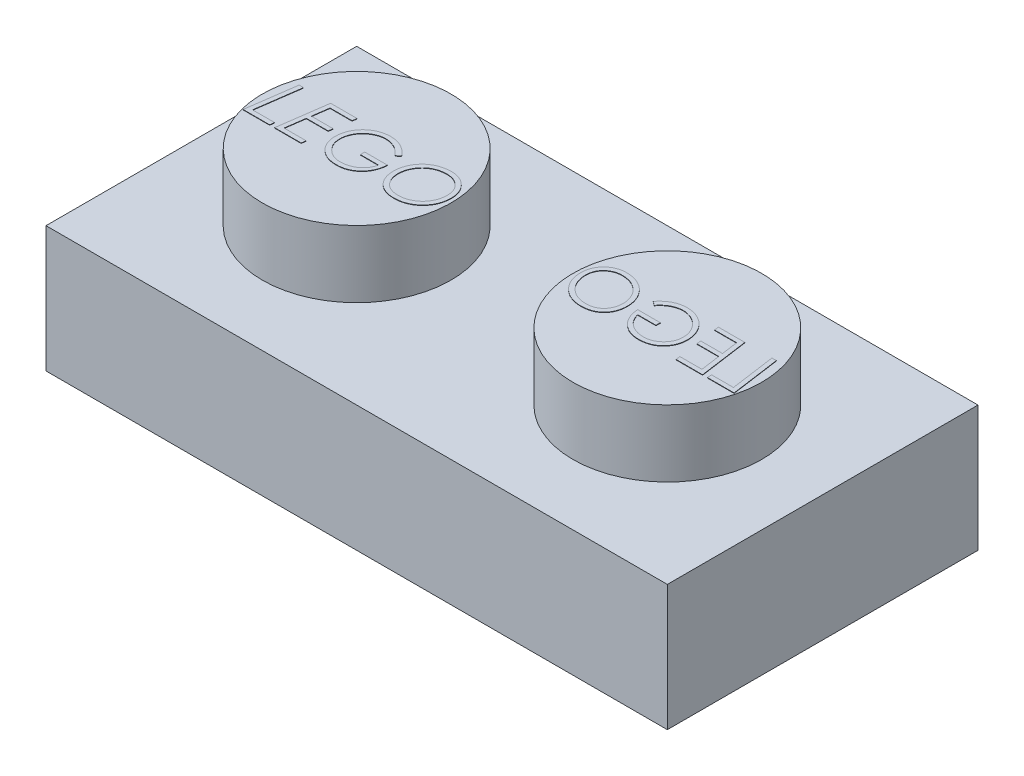
from build123d import *

# Parameters (mm, degrees)
SKETCH1_W           = 7.9
SKETCH1_H           = 7.9
BOSS_EXTRUDE1_DEPTH = 3.2
SKETCH2_R           = 2.4
BOSS_EXTRUDE2_DEPTH = 1.7
BOSS_EXTRUDE4_DEPTH = 0.01
SKETCH4_W           = 6.679581062
SKETCH4_H           = 6.679581062
CUT_EXTRUDE1_DEPTH  = 2.01
BOSS_EXTRUDE5_START = -2.01
BOSS_EXTRUDE5_DEPTH = 2.01


with BuildPart() as part:
    # Sketch1 → Boss-Extrude1 (new body)
    with BuildSketch(Plane(origin=(0, 0, 0), x_dir=(1, 0, 0), z_dir=(0, 1, 0))):
        with Locations((3.95, 3.95)):
            Rectangle(SKETCH1_W, SKETCH1_H)
    extrude(amount=BOSS_EXTRUDE1_DEPTH)

    # Sketch2 → Boss-Extrude2 (add)
    with BuildSketch(Plane(origin=(0, 3.2, 0), x_dir=(1, 0, 0), z_dir=(0, 1, 0))):
        with Locations(Location((3.95, 3.95, 0), (0, 0, 270))):
            Circle(SKETCH2_R)
    extrude(amount=BOSS_EXTRUDE2_DEPTH)

    # Sketch3 → Boss-Extrude4 (add)
    # profile 1 of 4: a face of its own
    with BuildSketch(Plane(origin=(0, 4.9, 0), x_dir=(1, 0, 0), z_dir=(0, 1, 0))):
        Polygon((1.832282536, 4.604898123), (1.945463626, 4.604898123), (1.785708017, 3.46707761), (2.346104652, 3.46707761), (2.331831815, 3.354898123), (1.657002088, 3.354898123), align=None)
    # profile 2 of 4: a face of its own
    with BuildSketch(Plane(origin=(0, 4.9, 0), x_dir=(1, 0, 0), z_dir=(0, 1, 0))):
        Polygon((3.307643113, 4.604898123), (3.289864668, 4.492718636), (2.730720036, 4.492718636), (2.672376687, 4.076051969), (3.227514908, 4.076051969), (3.211489267, 3.963872482), (2.656351046, 3.963872482), (2.586990069, 3.46707761), (3.147386703, 3.46707761), (3.132863466, 3.354898123), (2.458284139, 3.354898123), (2.633564588, 4.604898123), align=None)
    # profile 3 of 4: a face of its own
    with BuildSketch(Plane(origin=(0, 4.9, 0), x_dir=(1, 0, 0), z_dir=(0, 1, 0))):
        with BuildLine():
            Line((4.701873883, 4.341727049), (4.602214428, 4.268359661))
            add(Edge.make_bspline(
                [(4.602214428, 4.268359661), (4.594223081, 4.278463296), (4.578382454, 4.298490949), (4.552974208, 4.326751799), (4.526781942, 4.353389692), (4.49925824, 4.377917229), (4.471083571, 4.40112998), (4.441525281, 4.42204341), (4.410978563, 4.441207159), (4.379659496, 4.458649755), (4.347610579, 4.474125482), (4.315396207, 4.487732834), (4.282869127, 4.498922357), (4.250283005, 4.50864136), (4.217299487, 4.51587276), (4.18414763, 4.520710487), (4.150903008, 4.524293062), (4.128633082, 4.524610402), (4.117438786, 4.524769918)],
                knots=[0, 0, 0, 0, 1.088205139, 2.157064813, 3.209299296, 4.24303109, 5.270682624, 6.292193363, 7.299904734, 8.316436989, 9.319473328, 10.305733085, 11.269264382, 12.22444877, 13.177574148, 14.119122834, 15.054550362, 16, 16, 16, 16], degree=3))
            add(Edge.make_bspline(
                [(4.117438786, 4.524769918), (4.104994375, 4.524521107), (4.080132736, 4.524024028), (4.043033101, 4.520256885), (4.006376299, 4.51354748), (3.969908323, 4.504926578), (3.933893833, 4.493301772), (3.898252767, 4.479273564), (3.86309309, 4.462612711), (3.828430169, 4.443710217), (3.794953431, 4.422557236), (3.762954424, 4.399818018), (3.733183783, 4.375017311), (3.704650221, 4.34913067), (3.678490591, 4.320990985), (3.654040353, 4.291325456), (3.631570613, 4.259970376), (3.610753816, 4.22729124), (3.592321888, 4.193377608), (3.576332398, 4.158696131), (3.562301633, 4.123622124), (3.551463822, 4.087613068), (3.542488613, 4.051135011), (3.536702509, 4.013925289), (3.532682003, 3.976230124), (3.532229884, 3.950862463), (3.532002088, 3.938081216)],
                knots=[0, 0, 0, 0, 0.97704485, 1.95195533, 2.923843304, 3.901415526, 4.89212417, 5.89249681, 6.906854198, 7.94508701, 8.99059592, 10.014519948, 11.024825533, 12.031297736, 13.037428488, 14.038509295, 15.047964276, 16.064309815, 17.079005887, 18.075937854, 19.061713623, 20.042247028, 21.026191147, 22.008802999, 22.996754876, 24, 24, 24, 24], degree=3))
            add(Edge.make_bspline(
                [(3.532002088, 3.938081216), (3.532369323, 3.920940483), (3.533092921, 3.887166428), (3.54080397, 3.83756171), (3.552297071, 3.789703796), (3.569345009, 3.743984102), (3.590663785, 3.700113704), (3.616898701, 3.658340736), (3.647995923, 3.618632516), (3.683169388, 3.581124089), (3.721975609, 3.547190184), (3.762989457, 3.517071082), (3.806208637, 3.491553815), (3.851780792, 3.471217023), (3.899058754, 3.454481236), (3.948703848, 3.443615036), (4.000192874, 3.436168993), (4.035279814, 3.435410998), (4.053085822, 3.435026328)],
                knots=[0, 0, 0, 0, 1.019699772, 2.00921373, 2.981850619, 3.945611549, 4.907936516, 5.881372837, 6.876399243, 7.906447893, 8.938173367, 9.941073143, 10.932270214, 11.919723139, 12.908225854, 13.912405215, 14.940582182, 16, 16, 16, 16], degree=3))
            add(Edge.make_bspline(
                [(4.053085822, 3.435026328), (4.074581254, 3.435599426), (4.11748625, 3.436743331), (4.180872469, 3.447608002), (4.243162184, 3.464003995), (4.303115661, 3.48756372), (4.359892332, 3.516274774), (4.411741714, 3.54979345), (4.457784869, 3.587961635), (4.498384943, 3.630580026), (4.53303885, 3.678554542), (4.563120551, 3.731230233), (4.587740602, 3.789373269), (4.599634966, 3.830601123), (4.605720036, 3.851692995)],
                knots=[0, 0, 0, 0, 1.033792167, 2.063454529, 3.086685911, 4.12966393, 5.157365104, 6.144632769, 7.094686579, 8.02963692, 8.969786061, 9.935985671, 10.944065236, 12, 12, 12, 12], degree=3))
            Line((4.605720036, 3.851692995), (4.140976447, 3.851692995))
            Line((4.140976447, 3.851692995), (4.140976447, 3.963872482))
            Line((4.140976447, 3.963872482), (4.717899524, 3.963872482))
            add(Edge.make_bspline(
                [(4.717899524, 3.963872482), (4.715864452, 3.940537279), (4.711874195, 3.894782885), (4.69942647, 3.828086612), (4.68199329, 3.764774229), (4.659173945, 3.704861641), (4.630919519, 3.648505742), (4.59774963, 3.595348644), (4.559285746, 3.545571633), (4.515814341, 3.499721655), (4.46844757, 3.458302738), (4.417878433, 3.421925394), (4.364351012, 3.391393009), (4.308182236, 3.366007973), (4.248908241, 3.346854494), (4.187007442, 3.33278705), (4.12217798, 3.324364805), (4.078067373, 3.323359246), (4.055589828, 3.322846841)],
                knots=[0, 0, 0, 0, 1.098006248, 2.152910829, 3.176693714, 4.174102283, 5.154427425, 6.128677043, 7.108165613, 8.099464247, 9.087077226, 10.054952015, 11.015803916, 11.972468591, 12.940477937, 13.931877037, 14.946141749, 16, 16, 16, 16], degree=3))
            add(Edge.make_bspline(
                [(4.055589828, 3.322846841), (4.032525547, 3.323342362), (3.987411429, 3.324311611), (3.9214857, 3.332876212), (3.858807865, 3.34620412), (3.799404334, 3.365318809), (3.743277296, 3.389857102), (3.690679177, 3.420179827), (3.641268759, 3.455657405), (3.595689928, 3.496348401), (3.554559756, 3.541197331), (3.518567584, 3.589307242), (3.487743642, 3.639999747), (3.462901044, 3.693721351), (3.443468533, 3.750181555), (3.429856098, 3.809437188), (3.421311108, 3.871476007), (3.420325278, 3.913764014), (3.419822601, 3.935326809)],
                knots=[0, 0, 0, 0, 1.117903688, 2.186638197, 3.21780727, 4.221242465, 5.20706516, 6.182431358, 7.159609539, 8.151436913, 9.139682433, 10.10533578, 11.060397566, 12.011007066, 12.969638005, 13.950363306, 14.954883424, 16, 16, 16, 16], degree=3))
            add(Edge.make_bspline(
                [(3.419822601, 3.935326809), (3.420138952, 3.950859376), (3.420767729, 3.981731803), (3.424963713, 4.027616327), (3.432679126, 4.072646659), (3.442852825, 4.116910735), (3.455965552, 4.160496846), (3.471933961, 4.20328178), (3.491087489, 4.245242481), (3.513047729, 4.286115161), (3.537530339, 4.325600602), (3.564271155, 4.363247138), (3.593498243, 4.398542313), (3.624507556, 4.432098501), (3.658146201, 4.463054417), (3.693847346, 4.491888255), (3.731480716, 4.518905381), (3.77142415, 4.543221398), (3.812846375, 4.565137356), (3.855118915, 4.584605211), (3.898469674, 4.600573637), (3.942428974, 4.613905323), (3.987291028, 4.624144078), (4.032916476, 4.631801844), (4.079465257, 4.63599767), (4.110753822, 4.636631416), (4.12645321, 4.636949405)],
                knots=[0, 0, 0, 0, 1.01034602, 2.008157081, 2.993527994, 3.979930372, 4.960683832, 5.951959865, 6.948100503, 7.958563211, 8.967975239, 9.968308804, 10.959584837, 11.946808627, 12.938010319, 13.930059161, 14.930392727, 15.949048275, 16.969091794, 17.977364349, 18.973726886, 19.971641333, 20.963333569, 21.964771492, 22.978801278, 24, 24, 24, 24], degree=3))
            add(Edge.make_bspline(
                [(4.12645321, 4.636949405), (4.140647989, 4.63666956), (4.168739982, 4.636115737), (4.210476499, 4.63288549), (4.251380819, 4.627152534), (4.29129634, 4.618801418), (4.330484053, 4.608567941), (4.368675988, 4.59577053), (4.406070924, 4.580754735), (4.442474857, 4.563343269), (4.478143584, 4.543914061), (4.512619765, 4.521658579), (4.546625807, 4.497640881), (4.579591338, 4.471153536), (4.611552577, 4.442077414), (4.642675265, 4.410871755), (4.673242279, 4.377555225), (4.692243855, 4.353777591), (4.701873883, 4.341727049)],
                knots=[0, 0, 0, 0, 1.015105213, 2.008930748, 2.991454354, 3.966534974, 4.923490216, 5.886087319, 6.844809209, 7.803252371, 8.770243484, 9.747130909, 10.735853235, 11.746297741, 12.768902994, 13.824016992, 14.897208497, 16, 16, 16, 16], degree=3))
        make_face()
    # profile 4 of 4: a face of its own
    with BuildSketch(Plane(origin=(0, 4.9, 0), x_dir=(1, 0, 0), z_dir=(0, 1, 0))):
        with BuildLine():
            add(Edge.make_bspline(
                [(5.671925966, 4.636949405), (5.692400623, 4.63650345), (5.732667893, 4.635626396), (5.791703582, 4.627669814), (5.84816478, 4.614697282), (5.901922783, 4.596339067), (5.953136821, 4.572927607), (6.001690741, 4.544284414), (6.047399306, 4.510158163), (6.09025375, 4.471611385), (6.129154607, 4.429051867), (6.163160058, 4.383201547), (6.192058383, 4.334734533), (6.215910086, 4.283554512), (6.233823478, 4.229366588), (6.246743033, 4.172603876), (6.255145963, 4.113110877), (6.255950492, 4.072491917), (6.256361062, 4.051763107)],
                knots=[0, 0, 0, 0, 1.061681398, 2.087996504, 3.083659545, 4.062660971, 5.02945529, 5.999994507, 6.981138296, 7.983640916, 8.985844288, 9.966988076, 10.939736476, 11.908342154, 12.890058995, 13.894159216, 14.925339913, 16, 16, 16, 16], degree=3))
            add(Edge.make_bspline(
                [(6.256361062, 4.051763107), (6.25623821, 4.038988627), (6.255995471, 4.01374805), (6.253408976, 3.976225127), (6.249128591, 3.939561124), (6.243455349, 3.903597875), (6.235835613, 3.868539787), (6.226924527, 3.834140064), (6.216051359, 3.800598383), (6.20384118, 3.767696929), (6.189792262, 3.735595516), (6.173946521, 3.704324105), (6.15669213, 3.673663515), (6.137607818, 3.643838863), (6.11686312, 3.614849105), (6.094393683, 3.586665409), (6.070489857, 3.559187301), (6.044887258, 3.532733386), (6.018336956, 3.507212599), (5.990529993, 3.48355884), (5.962091012, 3.461350566), (5.932834084, 3.440746086), (5.90250067, 3.422121085), (5.871581935, 3.404690573), (5.839905885, 3.388861691), (5.807185809, 3.375183309), (5.773789823, 3.362832151), (5.739620564, 3.352089492), (5.704582969, 3.343076229), (5.668762424, 3.335500733), (5.632062087, 3.329787275), (5.594535036, 3.325855801), (5.556279304, 3.323200874), (5.530454147, 3.322965537), (5.51742877, 3.322846841)],
                knots=[0, 0, 0, 0, 1.057694632, 2.089855924, 3.112648636, 4.113725536, 5.103331559, 6.082381806, 7.055068159, 8.021768845, 8.98743121, 9.954922249, 10.923671581, 11.89959402, 12.885451751, 13.874212627, 14.883322035, 15.900071676, 16.921812937, 17.931632203, 18.921551953, 19.909055848, 20.892997665, 21.867769094, 22.84762411, 23.823252803, 24.802912784, 25.795362855, 26.787788858, 27.797679081, 28.826061376, 29.861826465, 30.921574152, 32, 32, 32, 32], degree=3))
            add(Edge.make_bspline(
                [(5.51742877, 3.322846841), (5.495540081, 3.323312388), (5.45279647, 3.324221496), (5.390401025, 3.331753811), (5.331466149, 3.34468508), (5.275615882, 3.361975519), (5.223270197, 3.38492417), (5.174339628, 3.412892082), (5.128783581, 3.445910526), (5.086763869, 3.483632016), (5.049135515, 3.525626819), (5.016044394, 3.570822838), (4.988418107, 3.619388761), (4.96538613, 3.670881503), (4.948106883, 3.725740589), (4.935156589, 3.783416472), (4.927613141, 3.844314319), (4.926699871, 3.88597706), (4.926232857, 3.907281937)],
                knots=[0, 0, 0, 0, 1.121422378, 2.189881799, 3.214223923, 4.209829567, 5.180887389, 6.136870002, 7.092517675, 8.058664933, 9.02481219, 9.976998316, 10.923432162, 11.882748215, 12.86205079, 13.865508147, 14.908495107, 16, 16, 16, 16], degree=3))
            add(Edge.make_bspline(
                [(4.926232857, 3.907281937), (4.92651465, 3.92390256), (4.927073619, 3.956871533), (4.931757127, 4.005792823), (4.939128338, 4.053761359), (4.950024433, 4.100549976), (4.963594459, 4.14639076), (4.979990494, 4.191253803), (5.000003008, 4.234848241), (5.022452359, 4.277389438), (5.047513645, 4.318359564), (5.07559856, 4.356880644), (5.105216605, 4.393691441), (5.137816677, 4.42780852), (5.172496353, 4.459796588), (5.209524734, 4.489546335), (5.248906172, 4.516814917), (5.290422211, 4.541753927), (5.333531205, 4.564369022), (5.378335052, 4.583562961), (5.424193072, 4.600182058), (5.471345954, 4.613795807), (5.519847317, 4.623918047), (5.569406413, 4.631466127), (5.620254649, 4.636113027), (5.6545551, 4.636668231), (5.671925966, 4.636949405)],
                knots=[0, 0, 0, 0, 1.027038055, 2.037251559, 3.03463374, 4.024476576, 5.003805404, 5.987972729, 6.973761106, 7.966047439, 8.95963362, 9.938921687, 10.910571097, 11.877553313, 12.852319973, 13.824735949, 14.81069978, 15.81041387, 16.816403723, 17.816876174, 18.82042938, 19.829469955, 20.847307225, 21.880377804, 22.926554263, 24, 24, 24, 24], degree=3))
        make_face()
        with BuildLine():
            add(Edge.make_bspline(
                [(5.671925966, 4.524769918), (5.65697579, 4.524545747), (5.627444828, 4.524102944), (5.583747158, 4.520086709), (5.541191397, 4.514393729), (5.499970629, 4.505322476), (5.459846772, 4.494612055), (5.421182876, 4.480527241), (5.383524652, 4.464643931), (5.34726264, 4.446055377), (5.312516644, 4.425361321), (5.279529586, 4.402463835), (5.248469657, 4.377453479), (5.219370347, 4.350164922), (5.191739723, 4.321307483), (5.166361885, 4.289965789), (5.142845474, 4.256628787), (5.121196386, 4.221501346), (5.10164712, 4.185107003), (5.08492909, 4.147719282), (5.070612165, 4.109847114), (5.058744989, 4.071497155), (5.049737471, 4.032481304), (5.043287884, 3.99291855), (5.039049877, 3.95269661), (5.03862585, 3.92565532), (5.038412344, 3.912039549)],
                knots=[0, 0, 0, 0, 1.093710758, 2.16039807, 3.20900896, 4.233234191, 5.246749975, 6.245527847, 7.241594159, 8.235879922, 9.224691631, 10.198908654, 11.171861231, 12.139893662, 13.116290872, 14.093089164, 15.087825051, 16.099756899, 17.110766713, 18.108591704, 19.094380672, 20.071961556, 21.043859171, 22.021859724, 23.00397114, 24, 24, 24, 24], degree=3))
            add(Edge.make_bspline(
                [(5.038412344, 3.912039549), (5.038625982, 3.900599914), (5.039049193, 3.877938292), (5.041777549, 3.844392517), (5.046595514, 3.811801965), (5.053065301, 3.780081073), (5.061542906, 3.749273697), (5.072183234, 3.719394567), (5.084405544, 3.690349568), (5.098393626, 3.662290632), (5.114175341, 3.635553687), (5.131389377, 3.61020951), (5.150226394, 3.586682218), (5.170360361, 3.564729612), (5.191972025, 3.544421151), (5.214980987, 3.52555365), (5.239648771, 3.508615875), (5.265465573, 3.492943288), (5.292687864, 3.479247808), (5.321165948, 3.467438697), (5.350786278, 3.457432665), (5.381544214, 3.449135171), (5.413524888, 3.442928532), (5.44663118, 3.438448028), (5.480905707, 3.435639812), (5.504152208, 3.435232585), (5.515926367, 3.435026328)],
                knots=[0, 0, 0, 0, 1.083699529, 2.146780792, 3.185591126, 4.202843058, 5.211856999, 6.209655863, 7.20532214, 8.195415879, 9.177202942, 10.14436246, 11.095191523, 12.029705806, 12.963818608, 13.902338257, 14.845476191, 15.796042213, 16.761390084, 17.729066592, 18.714222808, 19.721158958, 20.74459932, 21.797962164, 22.884686177, 24, 24, 24, 24], degree=3))
            add(Edge.make_bspline(
                [(5.515926367, 3.435026328), (5.530044188, 3.435228857), (5.558004277, 3.435629962), (5.599524853, 3.440000997), (5.64032433, 3.445959686), (5.680325762, 3.455225454), (5.71965402, 3.466535035), (5.757982705, 3.481070895), (5.795756024, 3.497476377), (5.83237428, 3.51683082), (5.867802238, 3.538111172), (5.901266528, 3.561837848), (5.932774032, 3.587459191), (5.962816859, 3.614626895), (5.990234918, 3.644356353), (6.016009711, 3.675809964), (6.039684501, 3.709331455), (6.061465654, 3.744601276), (6.080935982, 3.781209824), (6.097718361, 3.818903041), (6.112024773, 3.857287248), (6.123844079, 3.896320217), (6.132886835, 3.936161865), (6.139301688, 3.976648339), (6.14355343, 4.017951988), (6.143970816, 4.04574289), (6.144181575, 4.059775927)],
                knots=[0, 0, 0, 0, 1.029812959, 2.039525905, 3.043952503, 4.036919093, 5.033391511, 6.027870106, 7.026035071, 8.036794627, 9.047957848, 10.039952554, 11.027355318, 12.010276797, 12.992858524, 13.975534638, 14.976019862, 15.985163142, 16.99876328, 17.999396818, 18.993875413, 19.986244033, 20.973271002, 21.972624612, 22.976275263, 24, 24, 24, 24], degree=3))
            add(Edge.make_bspline(
                [(6.144181575, 4.059775927), (6.143688983, 4.077993105), (6.142724583, 4.113658826), (6.13551886, 4.16576722), (6.122807184, 4.214771606), (6.105892747, 4.261149785), (6.083400704, 4.304354629), (6.056090597, 4.344736825), (6.024020374, 4.382453222), (5.999069145, 4.404451295), (5.986429171, 4.415595238)],
                knots=[0, 0, 0, 0, 1.085318323, 2.124844004, 3.126009127, 4.096923137, 5.060061729, 6.020100862, 6.997008382, 8, 8, 8, 8], degree=3))
            add(Edge.make_bspline(
                [(5.986429171, 4.415595238), (5.97539623, 4.42431843), (5.953439426, 4.44167857), (5.917982347, 4.463870828), (5.881057133, 4.482788681), (5.842389242, 4.498145486), (5.802091847, 4.510165945), (5.760106575, 4.518646998), (5.716539836, 4.523741692), (5.686963766, 4.524423338), (5.671925966, 4.524769918)],
                knots=[0, 0, 0, 0, 0.992364662, 1.974918139, 2.947382948, 3.917989177, 4.907989082, 5.912266894, 6.938502841, 8, 8, 8, 8], degree=3))
        make_face(mode=Mode.SUBTRACT)
    extrude(amount=BOSS_EXTRUDE4_DEPTH)

    # Sketch4 → Cut-Extrude1 (cut)
    with BuildSketch(Plane.XZ):
        with Locations((3.960209469, -3.960209469)):
            Rectangle(SKETCH4_W, SKETCH4_H)
    extrude(amount=-CUT_EXTRUDE1_DEPTH, mode=Mode.SUBTRACT)

    # Sketch5 → Boss-Extrude5 (add)
    with BuildSketch(Plane(origin=(0, 3.2, 0), x_dir=(1, 0, 0), z_dir=(0, 1, 0)).offset(BOSS_EXTRUDE5_START)):
        with BuildLine():
            Line((6.369527619, 1.557811677), (5.363437843, 1.557811677))
            ThreePointArc((5.363437843, 1.557811677), (6.369527619, 0.551721901), (7.375617394, 1.557811677))
            ThreePointArc((7.375617394, 1.557811677), (7.080940521, 2.269224579), (6.369527619, 2.563901452))
            Line((6.369527619, 2.563901452), (6.369527619, 1.557811677))
        make_face()
        with BuildLine():
            Line((1.458127833, 2.579758881), (1.458127833, 1.557811677))
            Line((1.458127833, 1.557811677), (2.480075037, 1.557811677))
            ThreePointArc((2.480075037, 1.557811677), (2.180753631, 2.280437475), (1.458127833, 2.579758881))
        make_face()
        with BuildLine():
            Line((2.480075037, 1.557811677), (1.458127833, 1.557811677))
            Line((1.458127833, 1.557811677), (1.458127833, 2.579758881))
            ThreePointArc((1.458127833, 2.579758881), (0.735502035, 0.835185879), (2.480075037, 1.557811677))
        make_face()
        with BuildLine():
            ThreePointArc((5.605437996, 2.21232194), (5.425875301, 1.906719887), (5.363437843, 1.557811677))
            Line((5.363437843, 1.557811677), (6.369527619, 1.557811677))
            Line((6.369527619, 1.557811677), (6.369527619, 2.563901452))
            ThreePointArc((6.369527619, 2.563901452), (6.015263465, 2.499466361), (5.706377057, 2.31441459))
            ThreePointArc((5.706377057, 2.31441459), (5.656671092, 2.262613327), (5.605437996, 2.21232194))
        make_face()
        with BuildLine():
            ThreePointArc((7.385597221, 6.365232327), (6.369527619, 7.381301929), (5.353458016, 6.365232327))
            Line((5.353458016, 6.365232327), (6.369527619, 6.365232327))
            Line((6.369527619, 6.365232327), (6.369527619, 5.349162725))
            ThreePointArc((6.369527619, 5.349162725), (7.087997324, 5.646762621), (7.385597221, 6.365232327))
        make_face()
        with BuildLine():
            Line((6.369527619, 6.365232327), (5.353458016, 6.365232327))
            ThreePointArc((5.353458016, 6.365232327), (5.651057913, 5.646762621), (6.369527619, 5.349162725))
            Line((6.369527619, 5.349162725), (6.369527619, 6.365232327))
        make_face()
        with BuildLine():
            ThreePointArc((2.499242709, 6.365232327), (0.721948444, 7.101411716), (1.458127833, 5.324117451))
            Line((1.458127833, 5.324117451), (1.458127833, 6.365232327))
            Line((1.458127833, 6.365232327), (2.499242709, 6.365232327))
        make_face()
        with BuildLine():
            Line((1.458127833, 6.365232327), (1.458127833, 5.324117451))
            ThreePointArc((1.458127833, 5.324117451), (2.194307222, 5.629052938), (2.499242709, 6.365232327))
            Line((2.499242709, 6.365232327), (1.458127833, 6.365232327))
        make_face()
    extrude(amount=BOSS_EXTRUDE5_DEPTH)

    # Mirror1: part across plane


with BuildPart() as part_1:
    add(part.part)
    add(part.part.mirror(Plane(origin=(7.9, 3.2, 0), x_dir=(0, 0, 1), z_dir=(-1, 0, 0))))


solid = part_1.part
